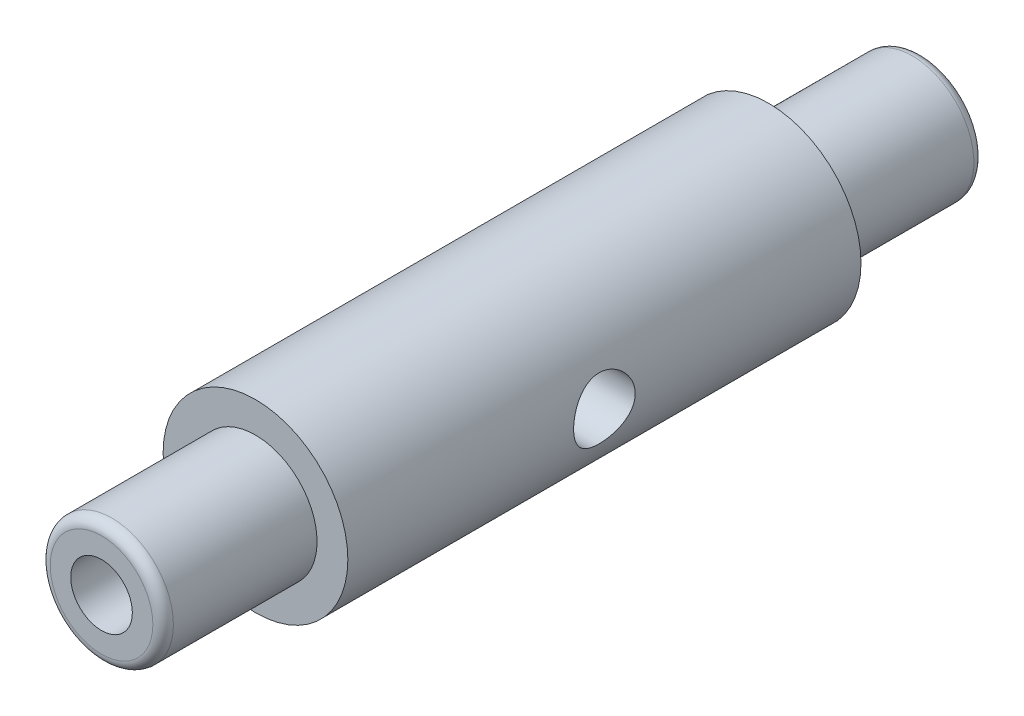
from build123d import *

# Parameters (mm, degrees)
FILLET1_R               = 1
HOLE1_D                 = 6
HOLE1_DEPTH             = 45
CUT_EXTRUDE1_DEPTH      = 42.976183724
CUT_EXTRUDE1_DEPTH_BACK = 42.976183724
SKETCH9_R               = 3


with BuildPart() as part:
    # Sketch1 → Revolve1 (revolve)
    with BuildSketch(Plane(origin=(0, 0, 0), x_dir=(0, 0, -1), z_dir=(1, 0, 0)), mode=Mode.PRIVATE) as revolve1_sk:
        Polygon((-40, 0), (-40, 6), (-25, 6), (-25, 9), (25, 9), (25, 6), (40, 6), (40, 0), align=None)
    revolve(revolve1_sk.sketch.rotate(Axis((0, 0, -40), (0, 0, 1)), 90), axis=Axis((0, 0, -40), (0, 0, 1)))

    # Fillet1
    fillet1_edges = [part.edges().sort_by_distance(p)[0] for p in [
        (6, 0, -40),
        (6, 0, 40),
    ]]
    fillet(fillet1_edges, radius=FILLET1_R)

    # Hole1
    with Locations(Plane.XY.offset(40)):
        with Locations((0, 0)):
            Hole(HOLE1_D / 2, depth=HOLE1_DEPTH)

    # Sketch9 → Cut-Extrude1 (cut, two sides: drawn at the far end of the back side and taken through both)
    with BuildSketch(Plane(origin=(0, 0, 0), x_dir=(0, 0, -1), z_dir=(1, 0, 0)).offset(-CUT_EXTRUDE1_DEPTH_BACK)):
        Circle(SKETCH9_R)
    extrude(amount=CUT_EXTRUDE1_DEPTH + CUT_EXTRUDE1_DEPTH_BACK, mode=Mode.SUBTRACT)


solid = part.part
